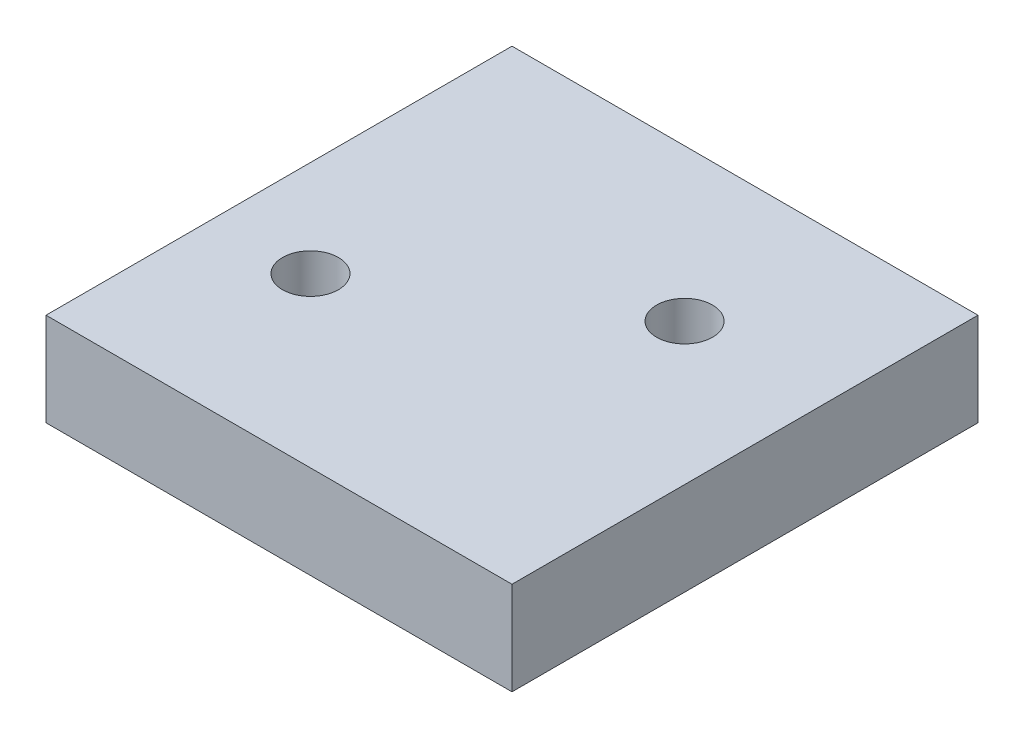
from build123d import *

# Parameters (mm, degrees)
SKETCH1_W                  = 100
SKETCH1_H                  = 100
BOSS_EXTRUDE1_DEPTH        = 20
F_12_0_12_DIAMETER_HOLE1_D = 12


with BuildPart() as part:
    # Sketch1 → Boss-Extrude1 (new body)
    with BuildSketch(Plane(origin=(0, 0, 0), x_dir=(1, 0, 0), z_dir=(0, 1, 0))):
        with Locations((50, 50)):
            Rectangle(SKETCH1_W, SKETCH1_H)
    extrude(amount=BOSS_EXTRUDE1_DEPTH)

    # Ø12.0 (12) Diameter Hole1 (through all)
    with Locations(Plane(origin=(0, 20, 0), x_dir=(1, 0, 0), z_dir=(0, 1, 0))):
        with Locations((69.621565786, 67.406480314), (20.647992382, 36.102952828)):
            Hole(F_12_0_12_DIAMETER_HOLE1_D / 2)


solid = part.part
